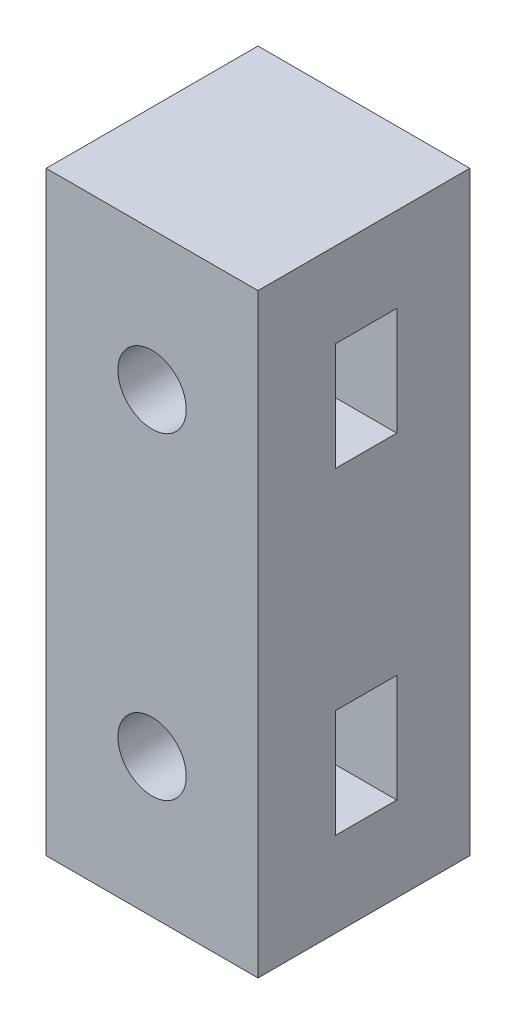
from build123d import *

# Parameters (mm, degrees)
SKETCH1_W           = 25.4
SKETCH1_H           = 25.4
BOSS_EXTRUDE1_DEPTH = 71.374
SKETCH2_R           = 4.09575
CUT_EXTRUDE1_DEPTH  = 19.05
SKETCH5_W           = 7.366
SKETCH5_H           = 12.954
CUT_EXTRUDE2_DEPTH  = 19.05


with BuildPart() as part:
    # Sketch1 → Boss-Extrude1 (new body)
    with BuildSketch(Plane(origin=(0, 0, 0), x_dir=(1, 0, 0), z_dir=(0, 1, 0))):
        with Locations((12.7, 12.7)):
            Rectangle(SKETCH1_W, SKETCH1_H)
    extrude(amount=BOSS_EXTRUDE1_DEPTH)

    # Sketch2 → Cut-Extrude1 (cut)
    with BuildSketch(Plane.XY):
        with Locations((12.7, 54.737)):
            Circle(SKETCH2_R)
        with Locations((12.7, 16.637)):
            Circle(SKETCH2_R)
    extrude(amount=-CUT_EXTRUDE1_DEPTH, mode=Mode.SUBTRACT)

    # Sketch5 → Cut-Extrude2 (cut)
    with BuildSketch(Plane(origin=(25.4, 0, 0), x_dir=(0, 0, -1), z_dir=(1, 0, 0))):
        with Locations((12.954, 54.737)):
            Rectangle(SKETCH5_W, SKETCH5_H)
        with Locations((12.954, 16.637)):
            Rectangle(SKETCH5_W, SKETCH5_H)
    extrude(amount=-CUT_EXTRUDE2_DEPTH, mode=Mode.SUBTRACT)


solid = part.part
